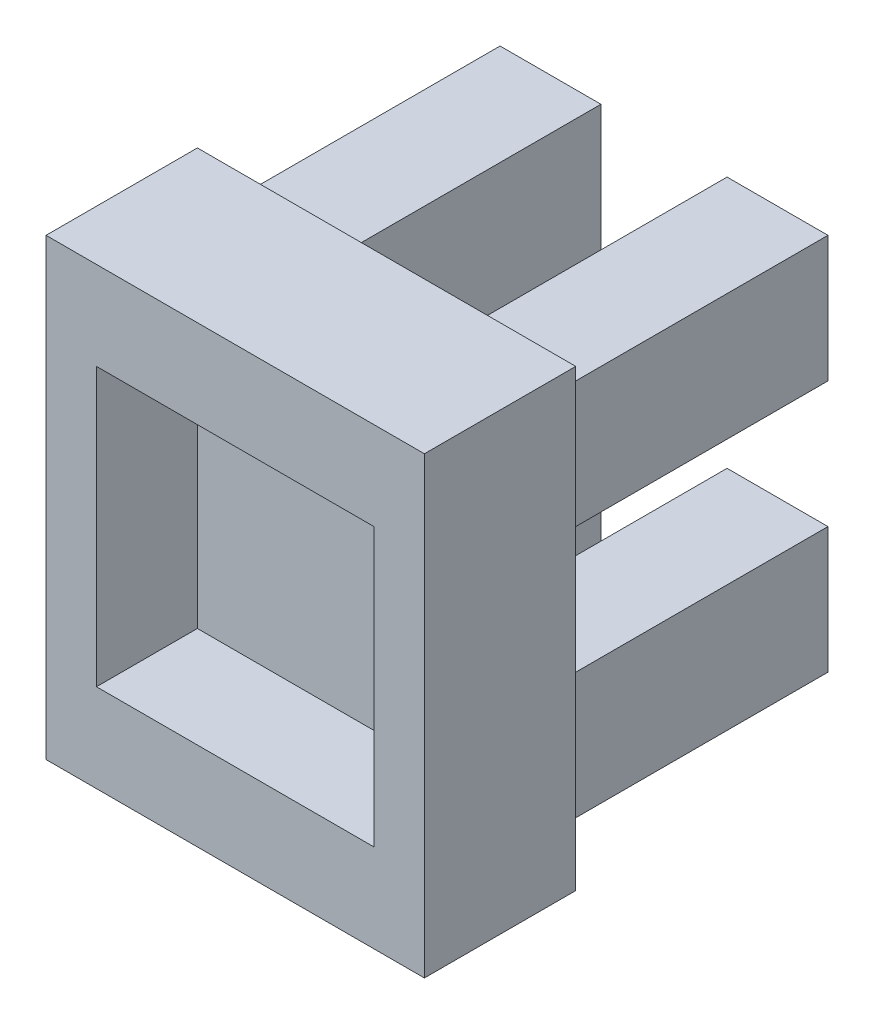
from build123d import *

# Parameters (mm, degrees)
SKETCH1_W           = 15
SKETCH1_H           = 18
BOSS_EXTRUDE1_DEPTH = 6
SKETCH2_W           = 11
SKETCH2_H           = 11
CUT_EXTRUDE1_DEPTH  = 4
SKETCH3_W           = 4
SKETCH3_H           = 5
BOSS_EXTRUDE2_DEPTH = 11


with BuildPart() as part:
    # Sketch1 → Boss-Extrude1 (new body)
    with BuildSketch(Plane.XY):
        with Locations((7.5, 9)):
            Rectangle(SKETCH1_W, SKETCH1_H)
    extrude(amount=BOSS_EXTRUDE1_DEPTH)

    # Sketch2 → Cut-Extrude1 (cut)
    with BuildSketch(Plane.XY.offset(6)):
        with Locations((7.5, 9)):
            Rectangle(SKETCH2_W, SKETCH2_H)
    extrude(amount=-CUT_EXTRUDE1_DEPTH, mode=Mode.SUBTRACT)

    # Sketch3 → Boss-Extrude2 (add)
    with BuildSketch(Plane(origin=(0, 0, 0), x_dir=(-1, 0, 0), z_dir=(0, 0, -1))):
        with Locations((-12, 14)):
            Rectangle(SKETCH3_W, SKETCH3_H)
        with Locations((-3, 14)):
            Rectangle(SKETCH3_W, SKETCH3_H)
        with Locations((-12, 4)):
            Rectangle(SKETCH3_W, SKETCH3_H)
        with Locations((-3, 4)):
            Rectangle(SKETCH3_W, SKETCH3_H)
    extrude(amount=BOSS_EXTRUDE2_DEPTH)


solid = part.part
